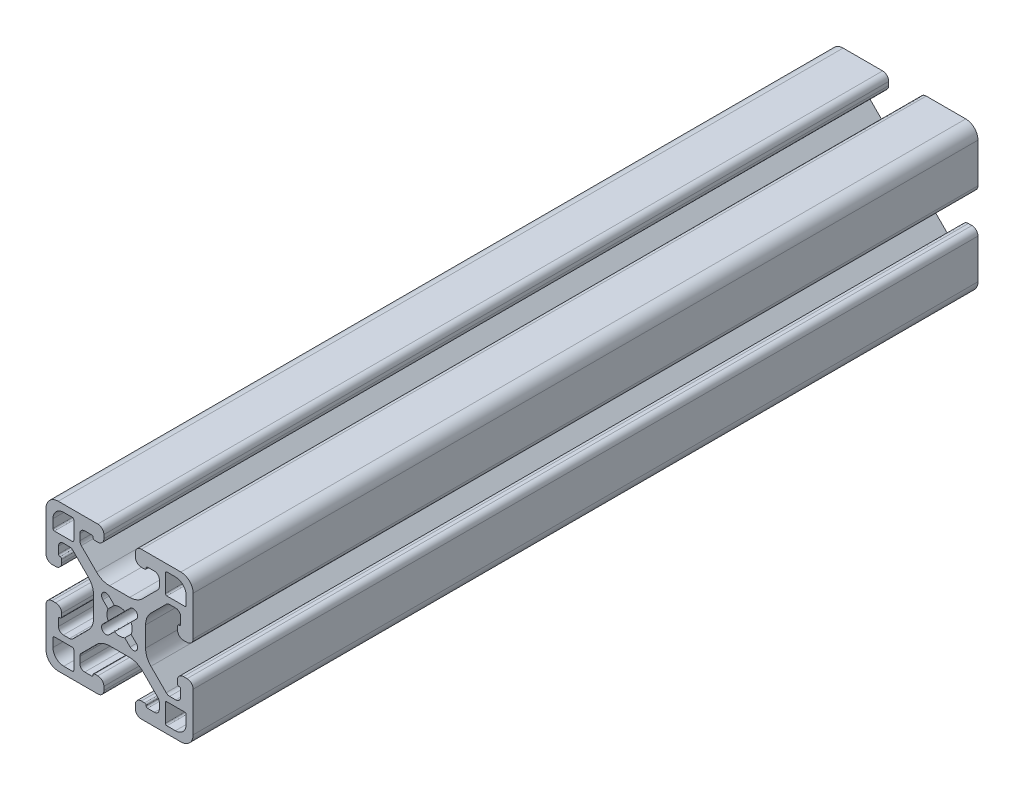
from build123d import *

# Parameters (mm, degrees)
EXTRUDE1_DEPTH = 203.2


with BuildPart() as part:
    # Sketch1 → Extrude1 (new body)
    with BuildSketch(Plane.XY):
        with BuildLine():
            Line((-46.536752228, -7.000622168), (-46.536752228, -8.774580164))
            ThreePointArc((-46.536752228, -8.774580164), (-46.907290083, -9.675221514), (-47.806745776, -10.048628264))
            Line((-47.806745776, -10.048628264), (-49.392633083, -10.048628264))
            ThreePointArc((-49.392633083, -10.048628264), (-49.878641042, -9.95195527), (-50.290658695, -9.676653876))
            Line((-50.290658695, -9.676653876), (-54.238761565, -5.728551005))
            ThreePointArc((-54.238761565, -5.728551005), (-55.26838878, -4.187604983), (-55.629945776, -2.369935216))
            Line((-55.629945776, -2.369935216), (-55.629945776, 2.846678689))
            ThreePointArc((-55.629945776, 2.846678689), (-55.26838878, 4.664348456), (-54.238761565, 6.205294478))
            Line((-54.238761565, 6.205294478), (-50.290658695, 10.153397348))
            ThreePointArc((-50.290658695, 10.153397348), (-49.878641042, 10.428698742), (-49.392633083, 10.525371736))
            Line((-49.392633083, 10.525371736), (-47.806745776, 10.525371736))
            ThreePointArc((-47.806745776, 10.525371736), (-46.907290079, 10.151964982), (-46.536752228, 9.251323623))
            Line((-46.536752228, 9.251323623), (-46.536752228, 7.47736564))
            ThreePointArc((-46.536752228, 7.47736564), (-46.648344767, 7.207957418), (-46.91775299, 7.096364878))
            Line((-46.91775299, 7.096364878), (-46.993953142, 7.096364878))
            ThreePointArc((-46.993953142, 7.096364878), (-47.263362671, 6.984771032), (-47.374953904, 6.715360422))
            Line((-47.374953904, 6.715360422), (-47.374945776, 5.877156465))
            ThreePointArc((-47.374945776, 5.877156465), (-46.913692136, 4.763614578), (-45.800145776, 4.302371736))
            Line((-45.800145776, 4.302371736), (-44.885745776, 4.302371736))
            ThreePointArc((-44.885745776, 4.302371736), (-43.772194017, 4.763619977), (-43.310945776, 5.877171736))
            Line((-43.310945776, 5.877171736), (-43.310945776, 16.113371736))
            ThreePointArc((-43.310945776, 16.113371736), (-44.240881746, 18.358435766), (-46.485945776, 19.288371736))
            Line((-46.485945776, 19.288371736), (-56.722145776, 19.288371736))
            ThreePointArc((-56.722145776, 19.288371736), (-57.835697535, 18.827123495), (-58.296945776, 17.713571736))
            Line((-58.296945776, 17.713571736), (-58.296945776, 16.799171736))
            ThreePointArc((-58.296945776, 16.799171736), (-57.835702934, 15.685625376), (-56.722161047, 15.224371736))
            Line((-56.722161047, 15.224371736), (-55.883957091, 15.224363608))
            ThreePointArc((-55.883957091, 15.224363608), (-55.61454648, 15.335954841), (-55.502952634, 15.60536437))
            Line((-55.502952634, 15.60536437), (-55.502952634, 15.681564523))
            ThreePointArc((-55.502952634, 15.681564523), (-55.391360095, 15.950972745), (-55.121951872, 16.062565285))
            Line((-55.121951872, 16.062565285), (-53.347993876, 16.062565285))
            ThreePointArc((-53.347993876, 16.062565285), (-52.447352526, 15.692027429), (-52.073945776, 14.792571736))
            Line((-52.073945776, 14.792571736), (-52.073945776, 13.206684429))
            ThreePointArc((-52.073945776, 13.206684429), (-52.17061877, 12.72067647), (-52.445920164, 12.308658817))
            Line((-52.445920164, 12.308658817), (-56.394023034, 8.360555947))
            ThreePointArc((-56.394023034, 8.360555947), (-57.934969057, 7.330928733), (-59.752638824, 6.969371736))
            Line((-59.752638824, 6.969371736), (-64.969252728, 6.969371736))
            ThreePointArc((-64.969252728, 6.969371736), (-66.786922496, 7.330928733), (-68.327868518, 8.360555947))
            Line((-68.327868518, 8.360555947), (-72.275971388, 12.308658817))
            ThreePointArc((-72.275971388, 12.308658817), (-72.551272782, 12.72067647), (-72.647945776, 13.206684429))
            Line((-72.647945776, 13.206684429), (-72.647945776, 14.792571736))
            ThreePointArc((-72.647945776, 14.792571736), (-72.274539022, 15.692027434), (-71.373897663, 16.062565285))
            Line((-71.373897663, 16.062565285), (-69.59993968, 16.062565285))
            ThreePointArc((-69.59993968, 16.062565285), (-69.330531458, 15.950972745), (-69.218938918, 15.681564523))
            Line((-69.218938918, 15.681564523), (-69.218938918, 15.60536437))
            ThreePointArc((-69.218938918, 15.60536437), (-69.107345072, 15.335954841), (-68.837934461, 15.224363608))
            Line((-68.837934461, 15.224363608), (-67.999730505, 15.224371736))
            ThreePointArc((-67.999730505, 15.224371736), (-66.886188618, 15.685625376), (-66.424945776, 16.799171736))
            Line((-66.424945776, 16.799171736), (-66.424945776, 17.713571736))
            ThreePointArc((-66.424945776, 17.713571736), (-66.886194017, 18.827123495), (-67.999745776, 19.288371736))
            Line((-67.999745776, 19.288371736), (-78.235945776, 19.288371736))
            ThreePointArc((-78.235945776, 19.288371736), (-80.481009806, 18.358435766), (-81.410945776, 16.113371736))
            Line((-81.410945776, 16.113371736), (-81.410945776, 5.877171736))
            ThreePointArc((-81.410945776, 5.877171736), (-80.949697535, 4.763619977), (-79.836145776, 4.302371736))
            Line((-79.836145776, 4.302371736), (-78.921745776, 4.302371736))
            ThreePointArc((-78.921745776, 4.302371736), (-77.808199416, 4.763614578), (-77.346945776, 5.877156465))
            Line((-77.346945776, 5.877156465), (-77.346937648, 6.715360422))
            ThreePointArc((-77.346937648, 6.715360422), (-77.458528881, 6.984771032), (-77.72793841, 7.096364878))
            Line((-77.72793841, 7.096364878), (-77.804138562, 7.096364878))
            ThreePointArc((-77.804138562, 7.096364878), (-78.073546785, 7.207957418), (-78.185139324, 7.47736564))
            Line((-78.185139324, 7.47736564), (-78.185139324, 9.251323637))
            ThreePointArc((-78.185139324, 9.251323637), (-77.814601469, 10.151964987), (-76.915145776, 10.525371736))
            Line((-76.915145776, 10.525371736), (-75.329258469, 10.525371736))
            ThreePointArc((-75.329258469, 10.525371736), (-74.84325051, 10.428698742), (-74.431232857, 10.153397348))
            Line((-74.431232857, 10.153397348), (-70.483129987, 6.205294478))
            ThreePointArc((-70.483129987, 6.205294478), (-69.453502773, 4.664348456), (-69.091945776, 2.846678689))
            Line((-69.091945776, 2.846678689), (-69.091945776, -2.369935216))
            ThreePointArc((-69.091945776, -2.369935216), (-69.453502773, -4.187604983), (-70.483129987, -5.728551005))
            Line((-70.483129987, -5.728551005), (-74.431232857, -9.676653876))
            ThreePointArc((-74.431232857, -9.676653876), (-74.84325051, -9.95195527), (-75.329258469, -10.048628264))
            Line((-75.329258469, -10.048628264), (-76.915145776, -10.048628264))
            ThreePointArc((-76.915145776, -10.048628264), (-77.814601474, -9.67522151), (-78.185139324, -8.774580151))
            Line((-78.185139324, -8.774580151), (-78.185139324, -7.000622168))
            ThreePointArc((-78.185139324, -7.000622168), (-78.073546785, -6.731213945), (-77.804138562, -6.619621406))
            Line((-77.804138562, -6.619621406), (-77.72793841, -6.619621406))
            ThreePointArc((-77.72793841, -6.619621406), (-77.458528881, -6.50802756), (-77.346937648, -6.238616949))
            Line((-77.346937648, -6.238616949), (-77.346945776, -5.400412993))
            ThreePointArc((-77.346945776, -5.400412993), (-77.808199416, -4.286871106), (-78.921745776, -3.825628264))
            Line((-78.921745776, -3.825628264), (-79.836145776, -3.825628264))
            ThreePointArc((-79.836145776, -3.825628264), (-80.949697535, -4.286876505), (-81.410945776, -5.400428264))
            Line((-81.410945776, -5.400428264), (-81.410945776, -15.636628264))
            ThreePointArc((-81.410945776, -15.636628264), (-80.481009806, -17.881692294), (-78.235945776, -18.811628264))
            Line((-78.235945776, -18.811628264), (-67.999745776, -18.811628264))
            ThreePointArc((-67.999745776, -18.811628264), (-66.886194017, -18.350380023), (-66.424945776, -17.236828264))
            Line((-66.424945776, -17.236828264), (-66.424945776, -16.322428264))
            ThreePointArc((-66.424945776, -16.322428264), (-66.886188618, -15.208881904), (-67.999730505, -14.747628264))
            Line((-67.999730505, -14.747628264), (-68.837934461, -14.747620136))
            ThreePointArc((-68.837934461, -14.747620136), (-69.107345072, -14.859211369), (-69.218938918, -15.128620898))
            Line((-69.218938918, -15.128620898), (-69.218938918, -15.20482105))
            ThreePointArc((-69.218938918, -15.20482105), (-69.330531458, -15.474229273), (-69.59993968, -15.585821812))
            Line((-69.59993968, -15.585821812), (-71.373897676, -15.585821812))
            ThreePointArc((-71.373897676, -15.585821812), (-72.274539027, -15.215283957), (-72.647945776, -14.315828264))
            Line((-72.647945776, -14.315828264), (-72.647945776, -12.729940957))
            ThreePointArc((-72.647945776, -12.729940957), (-72.551272782, -12.243932998), (-72.275971388, -11.831915345))
            Line((-72.275971388, -11.831915345), (-68.327868518, -7.883812475))
            ThreePointArc((-68.327868518, -7.883812475), (-66.786922496, -6.85418526), (-64.969252728, -6.492628264))
            Line((-64.969252728, -6.492628264), (-59.752638824, -6.492628264))
            ThreePointArc((-59.752638824, -6.492628264), (-57.934969057, -6.85418526), (-56.394023034, -7.883812475))
            Line((-56.394023034, -7.883812475), (-52.445920164, -11.831915345))
            ThreePointArc((-52.445920164, -11.831915345), (-52.17061877, -12.243932998), (-52.073945776, -12.729940957))
            Line((-52.073945776, -12.729940957), (-52.073945776, -14.315828264))
            ThreePointArc((-52.073945776, -14.315828264), (-52.44735253, -15.215283961), (-53.347993889, -15.585821812))
            Line((-53.347993889, -15.585821812), (-55.121951872, -15.585821812))
            ThreePointArc((-55.121951872, -15.585821812), (-55.391360095, -15.474229273), (-55.502952634, -15.20482105))
            Line((-55.502952634, -15.20482105), (-55.502952634, -15.128620898))
            ThreePointArc((-55.502952634, -15.128620898), (-55.61454648, -14.859211369), (-55.883957091, -14.747620136))
            Line((-55.883957091, -14.747620136), (-56.722161047, -14.747628264))
            ThreePointArc((-56.722161047, -14.747628264), (-57.835702934, -15.208881904), (-58.296945776, -16.322428264))
            Line((-58.296945776, -16.322428264), (-58.296945776, -17.236828264))
            ThreePointArc((-58.296945776, -17.236828264), (-57.835697535, -18.350380023), (-56.722145776, -18.811628264))
            Line((-56.722145776, -18.811628264), (-46.485945776, -18.811628264))
            ThreePointArc((-46.485945776, -18.811628264), (-44.240881746, -17.881692294), (-43.310945776, -15.636628264))
            Line((-43.310945776, -15.636628264), (-43.310945776, -5.400428264))
            ThreePointArc((-43.310945776, -5.400428264), (-43.772194017, -4.286876505), (-44.885745776, -3.825628264))
            Line((-44.885745776, -3.825628264), (-45.800145776, -3.825628264))
            ThreePointArc((-45.800145776, -3.825628264), (-46.913692136, -4.286871106), (-47.374945776, -5.400412993))
            Line((-47.374945776, -5.400412993), (-47.374953904, -6.238616949))
            ThreePointArc((-47.374953904, -6.238616949), (-47.263362671, -6.50802756), (-46.993953142, -6.619621406))
            Line((-46.993953142, -6.619621406), (-46.91775299, -6.619621406))
            ThreePointArc((-46.91775299, -6.619621406), (-46.648344767, -6.731213945), (-46.536752228, -7.000622168))
        make_face()
        with BuildLine():
            Line((-66.704246649, -2.488483035), (-65.333825803, -1.118062189))
            ThreePointArc((-65.333825803, -1.118062189), (-65.628655776, 0.238371736), (-65.333825803, 1.594805661))
            Line((-65.333825803, 1.594805661), (-66.704246649, 2.965226507))
            ThreePointArc((-66.704246649, 2.965226507), (-66.704246649, 4.581672609), (-65.087800547, 4.581672609))
            Line((-65.087800547, 4.581672609), (-63.717379701, 3.211251763))
            ThreePointArc((-63.717379701, 3.211251763), (-62.360945776, 3.506081736), (-61.004511851, 3.211251763))
            Line((-61.004511851, 3.211251763), (-59.721184579, 4.483982556))
            ThreePointArc((-59.721184579, 4.483982556), (-58.017644903, 4.581672609), (-58.115334956, 2.878132934))
            Line((-58.115334956, 2.878132934), (-59.38806575, 1.594805661))
            ThreePointArc((-59.38806575, 1.594805661), (-59.093235776, 0.238371736), (-59.38806575, -1.118062189))
            Line((-59.38806575, -1.118062189), (-58.017644903, -2.488483035))
            ThreePointArc((-58.017644903, -2.488483035), (-58.017644903, -4.104929137), (-59.634091005, -4.104929137))
            Line((-59.634091005, -4.104929137), (-61.004511851, -2.73450829))
            ThreePointArc((-61.004511851, -2.73450829), (-62.360945776, -3.029338264), (-63.717379701, -2.73450829))
            Line((-63.717379701, -2.73450829), (-65.087800547, -4.104929137))
            ThreePointArc((-65.087800547, -4.104929137), (-66.704246649, -4.104929137), (-66.704246649, -2.488483035))
        make_face(mode=Mode.SUBTRACT)
        with BuildLine():
            Line((-79.607545776, 12.481171736), (-79.607545776, 14.690971736))
            ThreePointArc((-79.607545776, 14.690971736), (-78.789202123, 16.666628083), (-76.813545776, 17.484971736))
            Line((-76.813545776, 17.484971736), (-74.603745776, 17.484971736))
            ThreePointArc((-74.603745776, 17.484971736), (-74.334338092, 17.37337942), (-74.222745776, 17.103971736))
            Line((-74.222745776, 17.103971736), (-74.222745776, 12.481171736))
            ThreePointArc((-74.222745776, 12.481171736), (-74.334338092, 12.211764053), (-74.603745776, 12.100171736))
            Line((-74.603745776, 12.100171736), (-79.226545776, 12.100171736))
            ThreePointArc((-79.226545776, 12.100171736), (-79.49595346, 12.211764053), (-79.607545776, 12.481171736))
        make_face(mode=Mode.SUBTRACT)
        with BuildLine():
            Line((-74.603745776, -17.008228264), (-76.813545776, -17.008228264))
            ThreePointArc((-76.813545776, -17.008228264), (-78.789202123, -16.18988461), (-79.607545776, -14.214228264))
            Line((-79.607545776, -14.214228264), (-79.607545776, -12.004428264))
            ThreePointArc((-79.607545776, -12.004428264), (-79.49595346, -11.73502058), (-79.226545776, -11.623428264))
            Line((-79.226545776, -11.623428264), (-74.603745776, -11.623428264))
            ThreePointArc((-74.603745776, -11.623428264), (-74.334338092, -11.73502058), (-74.222745776, -12.004428264))
            Line((-74.222745776, -12.004428264), (-74.222745776, -16.627228264))
            ThreePointArc((-74.222745776, -16.627228264), (-74.334338092, -16.896635947), (-74.603745776, -17.008228264))
        make_face(mode=Mode.SUBTRACT)
        with BuildLine():
            Line((-45.114345776, -12.004428264), (-45.114345776, -14.214228264))
            ThreePointArc((-45.114345776, -14.214228264), (-45.932689429, -16.18988461), (-47.908345776, -17.008228264))
            Line((-47.908345776, -17.008228264), (-50.118145776, -17.008228264))
            ThreePointArc((-50.118145776, -17.008228264), (-50.38755346, -16.896635947), (-50.499145776, -16.627228264))
            Line((-50.499145776, -16.627228264), (-50.499145776, -12.004428264))
            ThreePointArc((-50.499145776, -12.004428264), (-50.38755346, -11.73502058), (-50.118145776, -11.623428264))
            Line((-50.118145776, -11.623428264), (-45.495345776, -11.623428264))
            ThreePointArc((-45.495345776, -11.623428264), (-45.225938092, -11.73502058), (-45.114345776, -12.004428264))
        make_face(mode=Mode.SUBTRACT)
        with BuildLine():
            Line((-50.118145776, 17.484971736), (-47.908345776, 17.484971736))
            ThreePointArc((-47.908345776, 17.484971736), (-45.932689429, 16.666628083), (-45.114345776, 14.690971736))
            Line((-45.114345776, 14.690971736), (-45.114345776, 12.481171736))
            ThreePointArc((-45.114345776, 12.481171736), (-45.225938092, 12.211764053), (-45.495345776, 12.100171736))
            Line((-45.495345776, 12.100171736), (-50.118145776, 12.100171736))
            ThreePointArc((-50.118145776, 12.100171736), (-50.38755346, 12.211764053), (-50.499145776, 12.481171736))
            Line((-50.499145776, 12.481171736), (-50.499145776, 17.103971736))
            ThreePointArc((-50.499145776, 17.103971736), (-50.38755346, 17.37337942), (-50.118145776, 17.484971736))
        make_face(mode=Mode.SUBTRACT)
    extrude(amount=-EXTRUDE1_DEPTH)


solid = part.part
